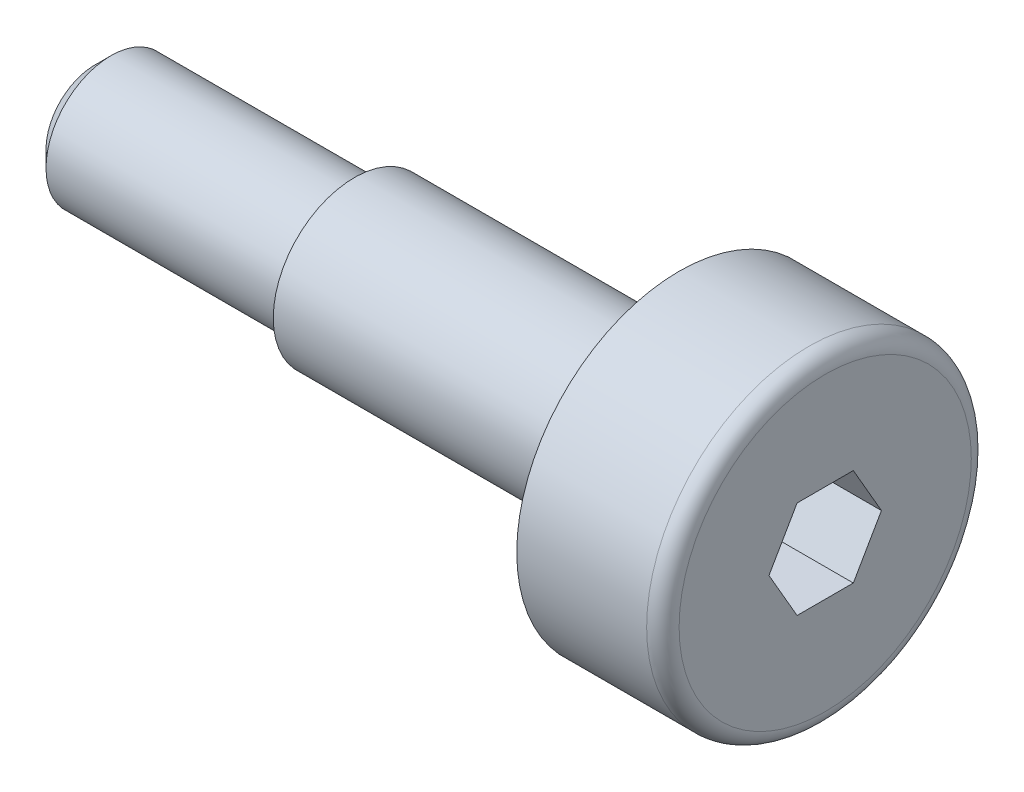
from build123d import *

# Parameters (mm, degrees)
CHAMFER1_SIZE      = 0.5
CUT_EXTRUDE1_DEPTH = 2.4


with BuildPart() as part:
    # Sketch1 → Revolve1 (revolve)
    with BuildSketch(Plane.XY):
        with BuildLine():
            Line((0, 0), (0, 4.5))
            ThreePointArc((0, 4.5), (-0.146446609, 4.853553391), (-0.5, 5))
            Line((-0.5, 5), (-4.5, 5))
            Line((-4.5, 5), (-4.5, 2.5))
            Line((-4.5, 2.5), (-14.5, 2.5))
            Line((-14.5, 2.5), (-14.5, 2))
            Line((-14.5, 2), (-22.5, 2))
            Line((-22.5, 2), (-22.5, 0))
            Line((-22.5, 0), (0, 0))
        make_face()
    revolve(axis=Axis((0, 0, 0), (1, 0, 0)))

    # Chamfer1
    chamfer1_edges = [part.edges().sort_by_distance(p)[0] for p in [
        (-22.5, -2, 0),
    ]]
    chamfer(chamfer1_edges, length=CHAMFER1_SIZE)

    # Sketch2 → Cut-Extrude1 (cut)
    with BuildSketch(Plane(origin=(0, 0, 0), x_dir=(0, 0, -1), z_dir=(1, 0, 0))):
        Polygon((1.732050808, 0), (0.866025404, 1.5), (-0.866025404, 1.5), (-1.732050808, 0), (-0.866025404, -1.5), (0.866025404, -1.5), align=None)
    extrude(amount=-CUT_EXTRUDE1_DEPTH, mode=Mode.SUBTRACT)


solid = part.part
